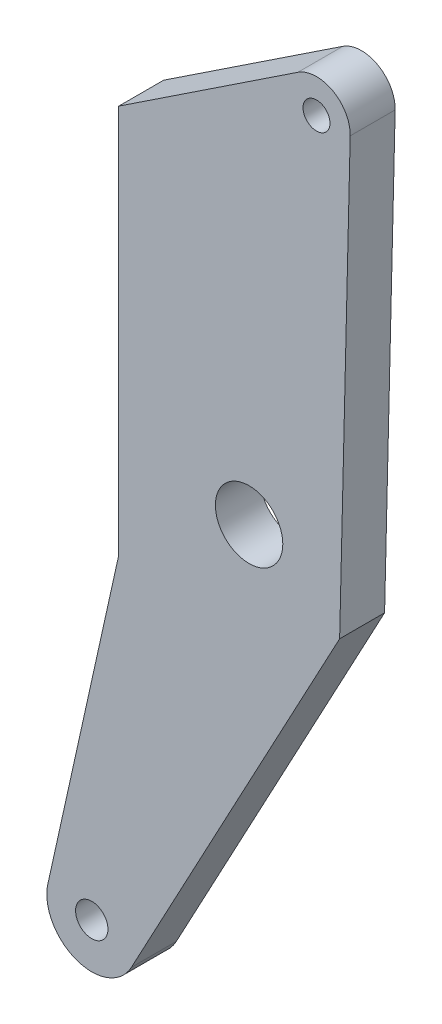
from build123d import *

# Parameters (mm, degrees)
SKETCH1_R           = 2.286
SKETCH1_R_2         = 1.905
SKETCH1_R_3         = 4.7625
BOSS_EXTRUDE1_DEPTH = 6.35
SKETCH2_R           = 1.905
CUT_EXTRUDE1_DEPTH  = 7.9375


with BuildPart() as part:
    # Sketch1 → Boss-Extrude1 (new body)
    with BuildSketch(Plane.XY):
        with BuildLine():
            Line((35.017380191, 51.909842308), (36.511130592, 114.185799576))
            ThreePointArc((36.511130592, 114.185799576), (34.05178904, 118.469313309), (29.116569093, 118.26817942))
            Line((29.116569093, 118.26817942), (3.81, 101.473802417))
            Line((3.81, 101.473802417), (3.81, 46.529605935))
            Line((3.81, 46.529605935), (-6.095047303, 1.78126314))
            ThreePointArc((-6.095047303, 1.78126314), (-2.403049878, -5.877742023), (5.597196577, -2.998981573))
            Line((5.597196577, -2.998981573), (35.017380191, 51.909842308))
        make_face()
        Circle(SKETCH1_R, mode=Mode.SUBTRACT)
        with Locations((31.75, 114.3)):
            Circle(SKETCH1_R_2, mode=Mode.SUBTRACT)
        with Locations((22.225, 59.483605935)):
            Circle(SKETCH1_R_3, mode=Mode.SUBTRACT)
    extrude(amount=BOSS_EXTRUDE1_DEPTH)

    # Sketch2 → Cut-Extrude1 (cut)
    with BuildSketch(Plane.ZY.offset(-3.81)):
        with Locations(Location((3.175, 89.876704176, 0), (0, 0, 270))):
            Circle(SKETCH2_R)
        with Locations(Location((3.175, 58.126704176, 0), (0, 0, 270))):
            Circle(SKETCH2_R)
    extrude(amount=-CUT_EXTRUDE1_DEPTH, mode=Mode.SUBTRACT)


solid = part.part
